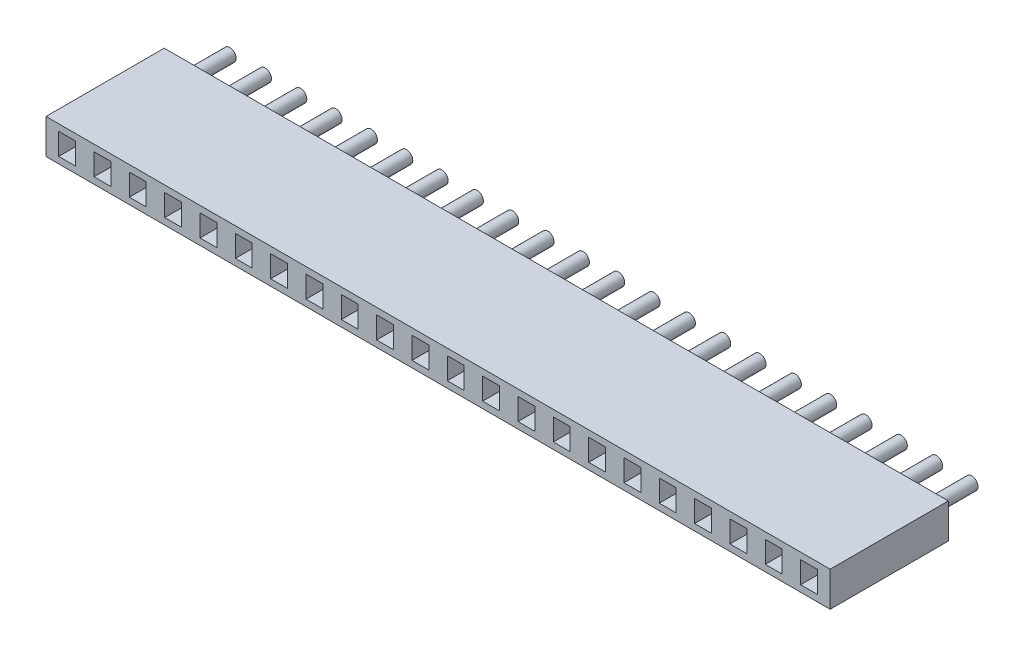
from build123d import *

# Parameters (mm, degrees)
SKETCH_1_W             = 56.38
SKETCH_1_H             = 2.5
EXTRUDE_1_DEPTH        = 8.5
SKETCH_2_W             = 1.210634416
SKETCH_2_H             = 1.563190286
CUT_EXTRUDE_1_DEPTH    = 5
PATTERN_LINEAR_1_COUNT = 12
PATTERN_LINEAR_1_PITCH = 2.54
PATTERN_LINEAR_2_COUNT = 11
PATTERN_LINEAR_2_PITCH = 2.54
SKETCH_3_R             = 0.45
EXTRUDE_2_DEPTH        = 3.2
PATTERN_LINEAR_3_COUNT = 22
PATTERN_LINEAR_3_PITCH = 2.54


with BuildPart() as part:
    # 草图1 → 凸台-拉伸1 (new body)
    with BuildSketch(Plane.XY):
        with Locations((28.19, 1.25)):
            Rectangle(SKETCH_1_W, SKETCH_1_H)
    extrude(amount=EXTRUDE_1_DEPTH)

    # 草图2 → 切除-拉伸1 (cut)
    with BuildSketch(Plane.XY.offset(8.5)):
        with Locations((26.92, 1.25)):
            Rectangle(SKETCH_2_W, SKETCH_2_H)
    cut_extrude_1 = extrude(amount=-CUT_EXTRUDE_1_DEPTH, mode=Mode.SUBTRACT)

    # 阵列(线性)1: 切除-拉伸1 ×12
    with Locations(*[(i * PATTERN_LINEAR_1_PITCH, 0, 0) for i in range(1, PATTERN_LINEAR_1_COUNT)]):
        add(cut_extrude_1, mode=Mode.SUBTRACT)

    # 阵列(线性)2: 切除-拉伸1 ×11
    with Locations(*[(-i * PATTERN_LINEAR_2_PITCH, 0, 0) for i in range(1, PATTERN_LINEAR_2_COUNT)]):
        add(cut_extrude_1, mode=Mode.SUBTRACT)

    # 草图3 → 凸台-拉伸2 (add)
    with BuildSketch(Plane(origin=(0, 0, 0), x_dir=(-1, 0, 0), z_dir=(0, 0, -1))):
        with Locations((-54.86, 1.25)):
            Circle(SKETCH_3_R)
    extrude_2 = extrude(amount=EXTRUDE_2_DEPTH)

    # 阵列(线性)3: 凸台-拉伸2 ×22
    with Locations(*[(-i * PATTERN_LINEAR_3_PITCH, 0, 0) for i in range(1, PATTERN_LINEAR_3_COUNT)]):
        add(extrude_2)


solid = part.part
